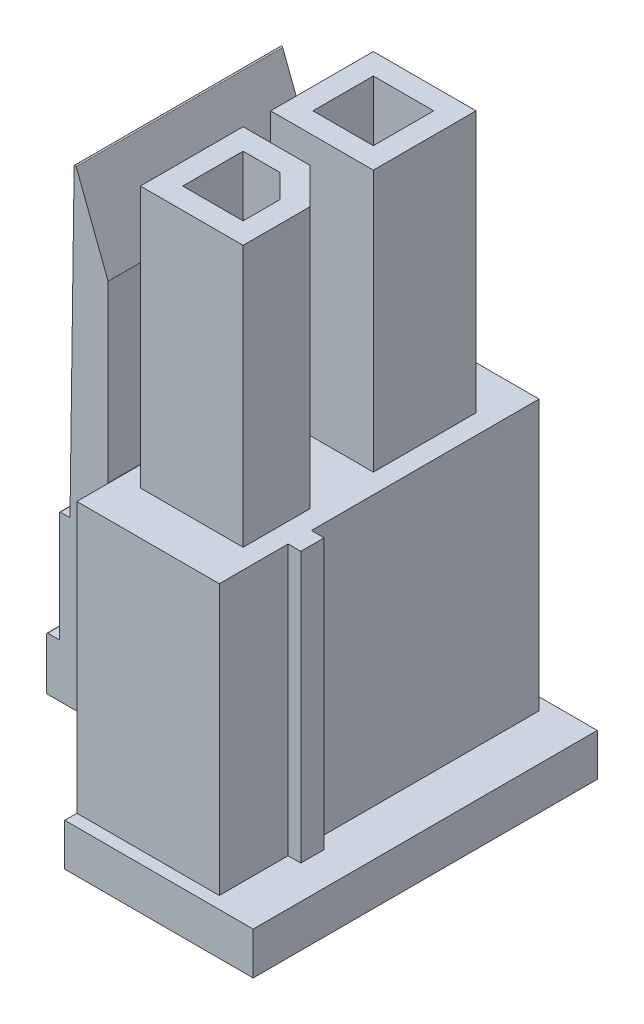
from build123d import *

# Parameters (mm, degrees)
SKETCH1_W           = 3.4163
SKETCH1_H           = 6.477
EXTRUDE1_DEPTH      = 3.8354
SKETCH2_W           = 0.5588
SKETCH2_H           = 6.477
EXTRUDE2_DEPTH      = 0.3048
SKETCH3_W           = 4.5212
SKETCH3_H           = 8.255
EXTRUDE3_DEPTH      = 1.016
SKETCH4_W           = 2.4638
SKETCH4_H           = 2.4638
SKETCH4_W_2         = 1.4478
SKETCH4_H_2         = 1.4478
EXTRUDE4_DEPTH      = 6.2738
SKETCH5_W           = 2.4638
SKETCH5_H           = 2.5146
EXTRUDE5_DEPTH      = 7.2898
EXTRUDE6_DEPTH      = 2.4765
EXTRUDE6_DEPTH_BACK = 2.4765


with BuildPart() as part:
    # Sketch1 → Extrude1 (new body)
    with BuildSketch(Plane.XY):
        with Locations((1.70815, 3.2385)):
            Rectangle(SKETCH1_W, SKETCH1_H)
    extrude1 = extrude(amount=EXTRUDE1_DEPTH)

    # Mirror1: Extrude1 across plane
    add(extrude1.mirror(Plane.XY.offset(3.8354)))

    # Sketch2 → Extrude2 (add)
    with BuildSketch(Plane(origin=(3.4163, 0, 0), x_dir=(0, 0, -1), z_dir=(1, 0, 0))):
        with Locations((-5.7404, 3.2385)):
            Rectangle(SKETCH2_W, SKETCH2_H)
    extrude(amount=EXTRUDE2_DEPTH)

    # Sketch3 → Extrude3 (add)
    with BuildSketch(Plane.XZ):
        with Locations((2.2606, 3.8354)):
            Rectangle(SKETCH3_W, SKETCH3_H)
    extrude(amount=EXTRUDE3_DEPTH)

    # Sketch4 → Extrude4 (add)
    # profile 1 of 2: a face of its own
    with BuildSketch(Plane(origin=(0, 6.477, 0), x_dir=(1, 0, 0), z_dir=(0, 1, 0))):
        Polygon((2.9464, -6.6294), (0.4826, -6.6294), (0.4826, -4.1656), (2.084295412, -4.1656), (2.9464, -5.027704588), align=None)
        Polygon((0.9906, -6.1214), (0.9906, -4.6736), (1.873874923, -4.6736), (2.4384, -5.238125077), (2.4384, -6.1214), align=None, mode=Mode.SUBTRACT)
    # profile 2 of 2: a face of its own
    with BuildSketch(Plane(origin=(0, 6.477, 0), x_dir=(1, 0, 0), z_dir=(0, 1, 0))):
        with Locations((1.7145, -2.2733)):
            Rectangle(SKETCH4_W, SKETCH4_H)
        with Locations((1.7145, -2.2733)):
            Rectangle(SKETCH4_W_2, SKETCH4_H_2, mode=Mode.SUBTRACT)
    extrude(amount=EXTRUDE4_DEPTH)

    # Sketch5 → Extrude5 (cut)
    with BuildSketch(Plane.XZ.offset(1.016)):
        with Locations((1.8669, 5.3086)):
            Rectangle(SKETCH5_W, SKETCH5_H)
        with Locations((1.8669, 2.3622)):
            Rectangle(SKETCH5_W, SKETCH5_H)
    extrude(amount=-EXTRUDE5_DEPTH, mode=Mode.SUBTRACT)

    # Sketch6 → Extrude6 (add, two sides: drawn at the far end of the back side and taken through both)
    with BuildSketch(Plane.XY.offset(3.8354).offset(-EXTRUDE6_DEPTH_BACK)):
        with BuildLine():
            ThreePointArc((-0.6096, 0.7874), (-0.617039488, 0.769439488), (-0.635, 0.762))
            Line((-0.635, 0.762), (-2.0574, 0.762))
            ThreePointArc((-2.0574, 0.762), (-2.075360512, 0.769439488), (-2.0828, 0.7874))
            Line((-2.0828, 0.7874), (-2.0828, 2.0066))
            ThreePointArc((-2.0828, 2.0066), (-2.075360512, 2.024560512), (-2.0574, 2.032))
            Line((-2.0574, 2.032), (-1.8034, 2.032))
            ThreePointArc((-1.8034, 2.032), (-1.785439488, 2.039439488), (-1.778, 2.0574))
            Line((-1.778, 2.0574), (-1.778, 4.6736))
            ThreePointArc((-1.778, 4.6736), (-1.770560512, 4.691560512), (-1.7526, 4.699))
            Line((-1.7526, 4.699), (-1.549059076, 4.699))
            ThreePointArc((-1.549059076, 4.699), (-1.53122032, 4.706318551), (-1.523661395, 4.724056788))
            Line((-1.523661395, 4.724056788), (-1.424588234, 12.055470697))
            ThreePointArc((-1.424588234, 12.055470697), (-1.403642896, 12.080134217), (-1.375472083, 12.06421562))
            Line((-1.375472083, 12.06421562), (-0.61128153, 10.069809609))
            ThreePointArc((-0.61128153, 10.069809609), (-0.61002392, 10.065342668), (-0.6096, 10.060721474))
            Line((-0.6096, 10.060721474), (-0.6096, 5.882065653))
            ThreePointArc((-0.6096, 5.882065653), (-0.602160512, 5.864105141), (-0.5842, 5.856665653))
            Line((-0.5842, 5.856665653), (0, 5.856665653))
            Line((0, 5.856665653), (0, 4.434265653))
            Line((0, 4.434265653), (-0.5842, 4.434265653))
            ThreePointArc((-0.5842, 4.434265653), (-0.602160512, 4.426826165), (-0.6096, 4.408865653))
            Line((-0.6096, 4.408865653), (-0.6096, 0.7874))
        make_face()
    extrude(amount=EXTRUDE6_DEPTH + EXTRUDE6_DEPTH_BACK)


solid = part.part
